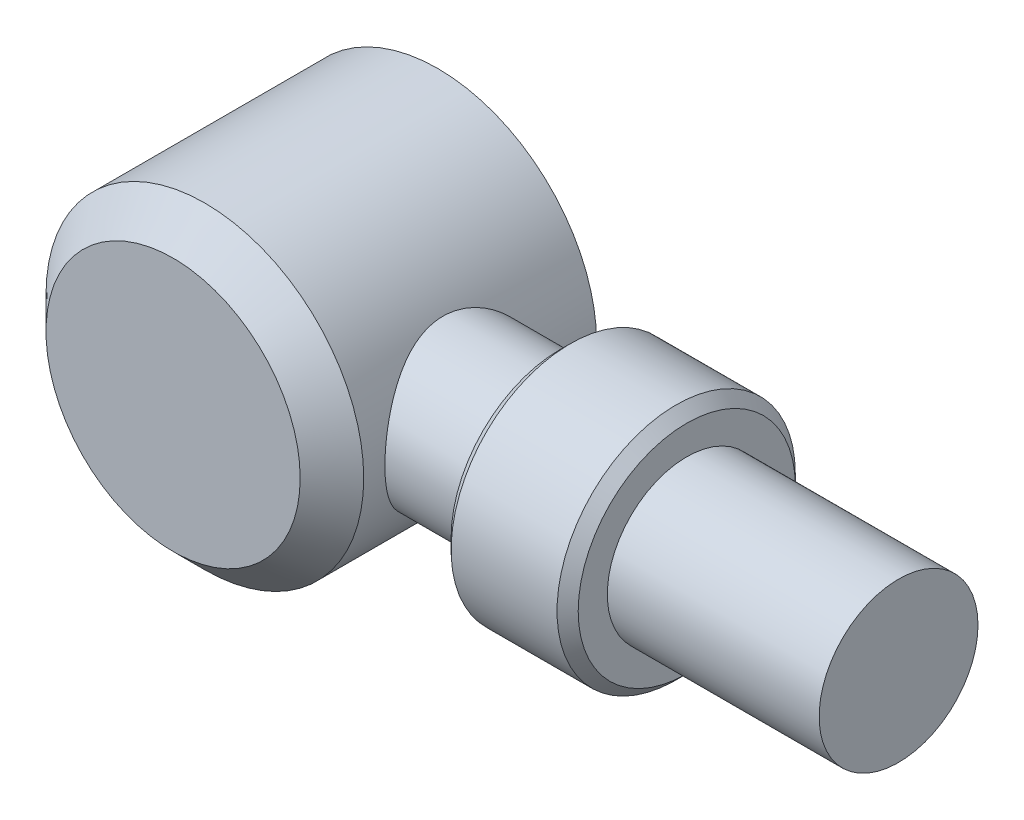
from build123d import *

# Parameters (mm, degrees)
SKETCH1_R                = 30
BOSS_EXTRUDE1_DEPTH      = 25
CHAMFER1_SIZE            = 6
BOSS_EXTRUDE2_REACH      = 149.272
BOSS_EXTRUDE2_END_RADIUS = 30
SKETCH2_R                = 15
SKETCH3_R                = 22.5
BOSS_EXTRUDE3_DEPTH      = 24
CHAMFER2_SIZE            = 2
SKETCH4_R                = 15
CUT_EXTRUDE1_DEPTH       = 10


with BuildPart() as part:
    # Sketch1 → Boss-Extrude1 (new, symmetric)
    with BuildSketch(Plane.XY):
        Circle(SKETCH1_R)
    extrude(amount=BOSS_EXTRUDE1_DEPTH, both=True)

    # Chamfer1
    chamfer1_edges = [part.edges().sort_by_distance(p)[0] for p in [
        (-30, 0, 25),
    ]]
    chamfer(chamfer1_edges, length=CHAMFER1_SIZE)

    # Boss-Extrude2: up to this cylinder (the profile starts outside it)
    boss_extrude2_end = Plane(origin=(0, 0, 0), z_dir=(0, 0, -1)) * Cylinder(BOSS_EXTRUDE2_END_RADIUS, 359.544, mode=Mode.PRIVATE)
    # Sketch2 → Boss-Extrude2 (add, up to the surface)
    with BuildSketch(Plane(origin=(112, 0, 0), x_dir=(0, 0, -1), z_dir=(1, 0, 0)), mode=Mode.PRIVATE) as boss_extrude2_sk1:
        Circle(SKETCH2_R)
    boss_extrude2_tool1 = extrude(boss_extrude2_sk1.sketch, amount=-BOSS_EXTRUDE2_REACH, mode=Mode.PRIVATE) - boss_extrude2_end
    add(boss_extrude2_tool1.solids().sort_by_distance((112, 0, 0))[0])

    # Sketch3 → Boss-Extrude3 (add)
    with BuildSketch(Plane(origin=(72, 0, 0), x_dir=(0, 0, -1), z_dir=(1, 0, 0))):
        Circle(SKETCH3_R)
    extrude(amount=-BOSS_EXTRUDE3_DEPTH)

    # Chamfer2
    chamfer2_edges = [part.edges().sort_by_distance(p)[0] for p in [
        (48, 0, 22.5),
        (72, 0, 22.5),
    ]]
    chamfer(chamfer2_edges, length=CHAMFER2_SIZE)

    # Sketch4 → Cut-Extrude1 (cut)
    with BuildSketch(Plane(origin=(0, 0, -25), x_dir=(-1, 0, 0), z_dir=(0, 0, -1))):
        Circle(SKETCH4_R)
    extrude(amount=-CUT_EXTRUDE1_DEPTH, mode=Mode.SUBTRACT)


solid = part.part
